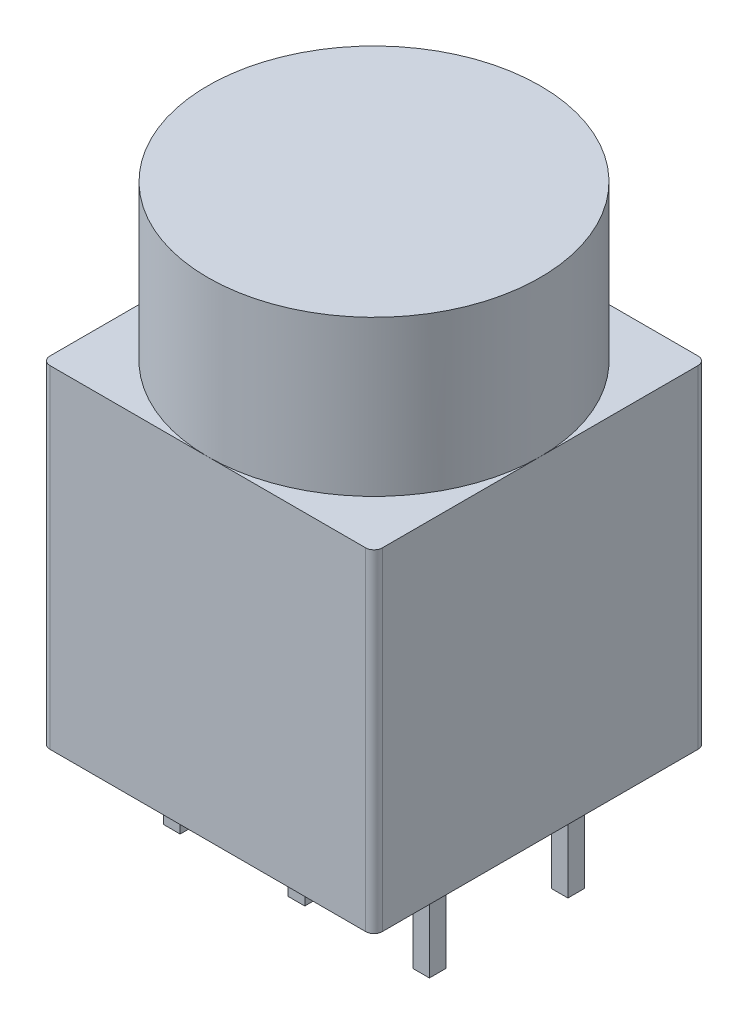
from build123d import *

# Parameters (mm, degrees)
BODY_DEPTH = 12
PINS_SK2_W = 0.6
PINS_SK2_H = 0.6
PINS_DEPTH = 15.5
CAP_SK3_R  = 6
CAP_DEPTH  = 5.6


with BuildPart() as part:
    # Body_Sk1 → Body (new body)
    with BuildSketch(Plane(origin=(0, 28.4, 0), x_dir=(1, 0, 0), z_dir=(0, 1, 0))):
        with BuildLine():
            Line((30.3, 28.5), (41.7, 28.5))
            ThreePointArc((41.7, 28.5), (41.912132034, 28.412132034), (42, 28.2))
            Line((42, 28.2), (42, 16.8))
            ThreePointArc((42, 16.8), (41.912132034, 16.587867966), (41.7, 16.5))
            Line((41.7, 16.5), (30.3, 16.5))
            ThreePointArc((30.3, 16.5), (30.087867966, 16.587867966), (30, 16.8))
            Line((30, 16.8), (30, 28.2))
            ThreePointArc((30, 28.2), (30.087867966, 28.412132034), (30.3, 28.5))
        make_face()
    extrude(amount=-BODY_DEPTH)

    # Pins_Sk2 → Pins (add)
    with BuildSketch(Plane(origin=(0, 28.4, 0), x_dir=(1, 0, 0), z_dir=(0, 1, 0))):
        with Locations((31.5, 25)):
            Rectangle(PINS_SK2_W, PINS_SK2_H)
        with Locations((31.5, 20)):
            Rectangle(PINS_SK2_W, PINS_SK2_H)
        with Locations((36, 25)):
            Rectangle(PINS_SK2_W, PINS_SK2_H)
        with Locations((36, 20)):
            Rectangle(PINS_SK2_W, PINS_SK2_H)
        with Locations((40.5, 25)):
            Rectangle(PINS_SK2_W, PINS_SK2_H)
        with Locations((40.5, 20)):
            Rectangle(PINS_SK2_W, PINS_SK2_H)
    extrude(amount=-PINS_DEPTH)

    # Cap_Sk3 → Cap (add)
    with BuildSketch(Plane(origin=(0, 28.4, 0), x_dir=(1, 0, 0), z_dir=(0, 1, 0))):
        with Locations(Location((36, 22.5, 0), (0, 0, 270))):
            Circle(CAP_SK3_R)
    extrude(amount=CAP_DEPTH)


solid = part.part
